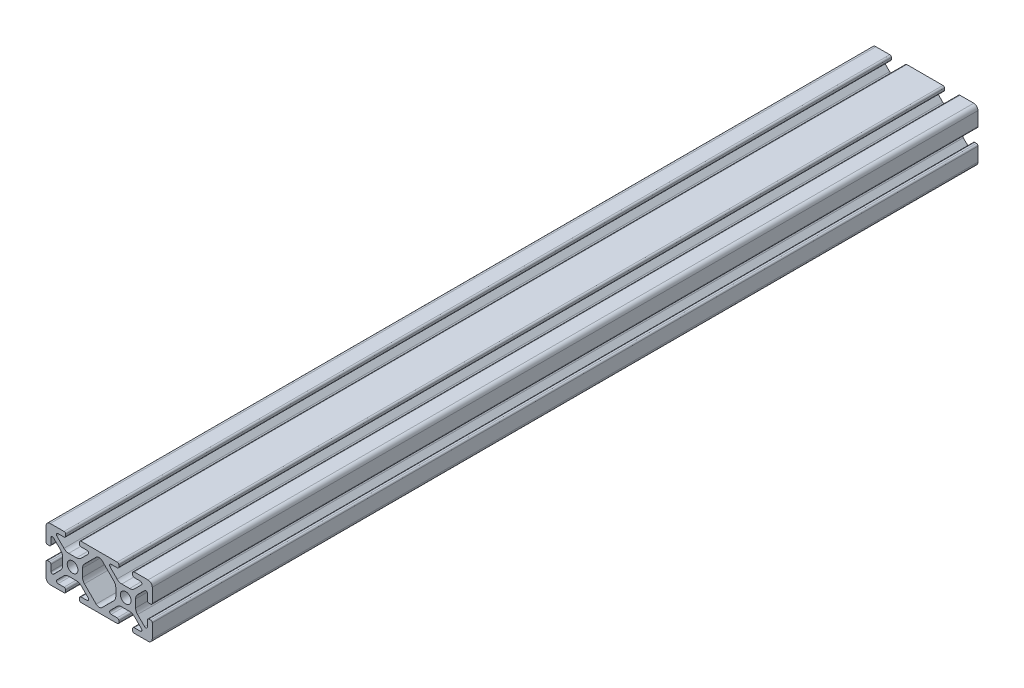
from build123d import *

# Parameters (mm, degrees)
SKETCH1_R           = 2.5527
BOSS_EXTRUDE1_DEPTH = 394.716


with BuildPart() as part:
    # Sketch1 → Boss-Extrude1 (new body)
    with BuildSketch(Plane.XY):
        with BuildLine():
            Line((-7.499820068, 9.062384633), (-4.117171405, 5.67973597))
            ThreePointArc((-4.117171405, 5.67973597), (-3.087127272, 4.991482484), (-1.872107374, 4.7498))
            Line((-1.872107374, 4.7498), (1.872107374, 4.7498))
            ThreePointArc((1.872107374, 4.7498), (3.087127272, 4.991482484), (4.117171405, 5.67973597))
            Line((4.117171405, 5.67973597), (7.499820068, 9.062384633))
            ThreePointArc((7.499820068, 9.062384633), (7.665000904, 9.892804775), (6.9610047, 10.3632))
            Line((6.9610047, 10.3632), (4.064, 10.3632))
            ThreePointArc((4.064, 10.3632), (3.525184633, 10.586384633), (3.302, 11.1252))
            Line((3.302, 11.1252), (3.302, 11.938))
            ThreePointArc((3.302, 11.938), (3.525184633, 12.476815367), (4.064, 12.7))
            Line((4.064, 12.7), (10.668, 12.7))
            Line((10.668, 12.7), (14.732, 12.7))
            Line((14.732, 12.7), (21.336, 12.7))
            ThreePointArc((21.336, 12.7), (21.874815367, 12.476815367), (22.098, 11.938))
            Line((22.098, 11.938), (22.098, 11.1252))
            ThreePointArc((22.098, 11.1252), (21.874815367, 10.586384633), (21.336, 10.3632))
            Line((21.336, 10.3632), (18.4389953, 10.3632))
            ThreePointArc((18.4389953, 10.3632), (17.734999096, 9.892804775), (17.900179932, 9.062384633))
            Line((17.900179932, 9.062384633), (21.282828595, 5.67973597))
            ThreePointArc((21.282828595, 5.67973597), (22.312872728, 4.991482484), (23.527892626, 4.7498))
            Line((23.527892626, 4.7498), (27.272107374, 4.7498))
            ThreePointArc((27.272107374, 4.7498), (28.487127272, 4.991482484), (29.517171405, 5.67973597))
            Line((29.517171405, 5.67973597), (32.899820068, 9.062384633))
            ThreePointArc((32.899820068, 9.062384633), (33.065000904, 9.892804775), (32.3610047, 10.3632))
            Line((32.3610047, 10.3632), (29.464, 10.3632))
            ThreePointArc((29.464, 10.3632), (28.925184633, 10.586384633), (28.702, 11.1252))
            Line((28.702, 11.1252), (28.702, 11.938))
            ThreePointArc((28.702, 11.938), (28.925184633, 12.476815367), (29.464, 12.7))
            Line((29.464, 12.7), (36.068, 12.7))
            ThreePointArc((36.068, 12.7), (37.504840979, 12.104840979), (38.1, 10.668))
            Line((38.1, 10.668), (38.1, 4.064))
            ThreePointArc((38.1, 4.064), (37.876815367, 3.525184633), (37.338, 3.302))
            Line((37.338, 3.302), (36.5252, 3.302))
            ThreePointArc((36.5252, 3.302), (35.986384633, 3.525184633), (35.7632, 4.064))
            Line((35.7632, 4.064), (35.7632, 6.9610047))
            ThreePointArc((35.7632, 6.9610047), (35.292804775, 7.665000904), (34.462384633, 7.499820068))
            Line((34.462384633, 7.499820068), (31.07973597, 4.117171405))
            ThreePointArc((31.07973597, 4.117171405), (30.391482484, 3.087127272), (30.1498, 1.872107374))
            Line((30.1498, 1.872107374), (30.1498, -1.872107374))
            ThreePointArc((30.1498, -1.872107374), (30.391482484, -3.087127272), (31.07973597, -4.117171405))
            Line((31.07973597, -4.117171405), (34.462384633, -7.499820068))
            ThreePointArc((34.462384633, -7.499820068), (35.292804775, -7.665000904), (35.7632, -6.9610047))
            Line((35.7632, -6.9610047), (35.7632, -4.064))
            ThreePointArc((35.7632, -4.064), (35.986384633, -3.525184633), (36.5252, -3.302))
            Line((36.5252, -3.302), (37.338, -3.302))
            ThreePointArc((37.338, -3.302), (37.876815367, -3.525184633), (38.1, -4.064))
            Line((38.1, -4.064), (38.1, -10.668))
            ThreePointArc((38.1, -10.668), (37.504840979, -12.104840979), (36.068, -12.7))
            Line((36.068, -12.7), (29.464, -12.7))
            ThreePointArc((29.464, -12.7), (28.925184633, -12.476815367), (28.702, -11.938))
            Line((28.702, -11.938), (28.702, -11.1252))
            ThreePointArc((28.702, -11.1252), (28.925184633, -10.586384633), (29.464, -10.3632))
            Line((29.464, -10.3632), (32.3610047, -10.3632))
            ThreePointArc((32.3610047, -10.3632), (33.065000904, -9.892804775), (32.899820068, -9.062384633))
            Line((32.899820068, -9.062384633), (29.517171405, -5.67973597))
            ThreePointArc((29.517171405, -5.67973597), (28.487127272, -4.991482484), (27.272107374, -4.7498))
            Line((27.272107374, -4.7498), (23.527892626, -4.7498))
            ThreePointArc((23.527892626, -4.7498), (22.312872728, -4.991482484), (21.282828595, -5.67973597))
            Line((21.282828595, -5.67973597), (17.900179932, -9.062384633))
            ThreePointArc((17.900179932, -9.062384633), (17.734999096, -9.892804775), (18.4389953, -10.3632))
            Line((18.4389953, -10.3632), (21.336, -10.3632))
            ThreePointArc((21.336, -10.3632), (21.874815367, -10.586384633), (22.098, -11.1252))
            Line((22.098, -11.1252), (22.098, -11.938))
            ThreePointArc((22.098, -11.938), (21.874815367, -12.476815367), (21.336, -12.7))
            Line((21.336, -12.7), (14.732, -12.7))
            Line((14.732, -12.7), (10.668, -12.7))
            Line((10.668, -12.7), (4.064, -12.7))
            ThreePointArc((4.064, -12.7), (3.525184633, -12.476815367), (3.302, -11.938))
            Line((3.302, -11.938), (3.302, -11.1252))
            ThreePointArc((3.302, -11.1252), (3.525184633, -10.586384633), (4.064, -10.3632))
            Line((4.064, -10.3632), (6.9610047, -10.3632))
            ThreePointArc((6.9610047, -10.3632), (7.665000904, -9.892804775), (7.499820068, -9.062384633))
            Line((7.499820068, -9.062384633), (4.117171405, -5.67973597))
            ThreePointArc((4.117171405, -5.67973597), (3.087127272, -4.991482484), (1.872107374, -4.7498))
            Line((1.872107374, -4.7498), (-1.872107374, -4.7498))
            ThreePointArc((-1.872107374, -4.7498), (-3.087127272, -4.991482484), (-4.117171405, -5.67973597))
            Line((-4.117171405, -5.67973597), (-7.499820068, -9.062384633))
            ThreePointArc((-7.499820068, -9.062384633), (-7.665000904, -9.892804775), (-6.9610047, -10.3632))
            Line((-6.9610047, -10.3632), (-4.064, -10.3632))
            ThreePointArc((-4.064, -10.3632), (-3.525184633, -10.586384633), (-3.302, -11.1252))
            Line((-3.302, -11.1252), (-3.302, -11.938))
            ThreePointArc((-3.302, -11.938), (-3.525184633, -12.476815367), (-4.064, -12.7))
            Line((-4.064, -12.7), (-10.668, -12.7))
            ThreePointArc((-10.668, -12.7), (-12.104840979, -12.104840979), (-12.7, -10.668))
            Line((-12.7, -10.668), (-12.7, -4.064))
            ThreePointArc((-12.7, -4.064), (-12.476815367, -3.525184633), (-11.938, -3.302))
            Line((-11.938, -3.302), (-11.1252, -3.302))
            ThreePointArc((-11.1252, -3.302), (-10.586384633, -3.525184633), (-10.3632, -4.064))
            Line((-10.3632, -4.064), (-10.3632, -6.9610047))
            ThreePointArc((-10.3632, -6.9610047), (-9.892804775, -7.665000904), (-9.062384633, -7.499820068))
            Line((-9.062384633, -7.499820068), (-5.67973597, -4.117171405))
            ThreePointArc((-5.67973597, -4.117171405), (-4.991482484, -3.087127272), (-4.7498, -1.872107374))
            Line((-4.7498, -1.872107374), (-4.7498, 1.872107374))
            ThreePointArc((-4.7498, 1.872107374), (-4.991482484, 3.087127272), (-5.67973597, 4.117171405))
            Line((-5.67973597, 4.117171405), (-9.062384633, 7.499820068))
            ThreePointArc((-9.062384633, 7.499820068), (-9.892804775, 7.665000904), (-10.3632, 6.9610047))
            Line((-10.3632, 6.9610047), (-10.3632, 4.064))
            ThreePointArc((-10.3632, 4.064), (-10.586384633, 3.525184633), (-11.1252, 3.302))
            Line((-11.1252, 3.302), (-11.938, 3.302))
            ThreePointArc((-11.938, 3.302), (-12.476815367, 3.525184633), (-12.7, 4.064))
            Line((-12.7, 4.064), (-12.7, 10.668))
            ThreePointArc((-12.7, 10.668), (-12.104840979, 12.104840979), (-10.668, 12.7))
            Line((-10.668, 12.7), (-4.064, 12.7))
            ThreePointArc((-4.064, 12.7), (-3.525184633, 12.476815367), (-3.302, 11.938))
            Line((-3.302, 11.938), (-3.302, 11.1252))
            ThreePointArc((-3.302, 11.1252), (-3.525184633, 10.586384633), (-4.064, 10.3632))
            Line((-4.064, 10.3632), (-6.9610047, 10.3632))
            ThreePointArc((-6.9610047, 10.3632), (-7.665000904, 9.892804775), (-7.499820068, 9.062384633))
        make_face()
        with Locations(Location((0, 0, 0), (0, 0, 180))):
            Circle(SKETCH1_R, mode=Mode.SUBTRACT)
        with Locations(Location((25.4, 0, 0), (0, 0, 180))):
            Circle(SKETCH1_R, mode=Mode.SUBTRACT)
        with BuildLine():
            Line((4.7498, -1.872107374), (4.7498, 1.872107374))
            ThreePointArc((4.7498, 1.872107374), (4.991482484, 3.087127272), (5.67973597, 4.117171405))
            Line((5.67973597, 4.117171405), (11.263159021, 9.700594456))
            ThreePointArc((11.263159021, 9.700594456), (12.7, 10.295753476), (14.136840979, 9.700594456))
            Line((14.136840979, 9.700594456), (19.72026403, 4.117171405))
            ThreePointArc((19.72026403, 4.117171405), (20.408517516, 3.087127272), (20.6502, 1.872107374))
            Line((20.6502, 1.872107374), (20.6502, -1.872107374))
            ThreePointArc((20.6502, -1.872107374), (20.408517516, -3.087127272), (19.72026403, -4.117171405))
            Line((19.72026403, -4.117171405), (14.136840979, -9.700594456))
            ThreePointArc((14.136840979, -9.700594456), (12.7, -10.295753476), (11.263159021, -9.700594456))
            Line((11.263159021, -9.700594456), (5.67973597, -4.117171405))
            ThreePointArc((5.67973597, -4.117171405), (4.991482484, -3.087127272), (4.7498, -1.872107374))
        make_face(mode=Mode.SUBTRACT)
    extrude(amount=BOSS_EXTRUDE1_DEPTH)


solid = part.part
